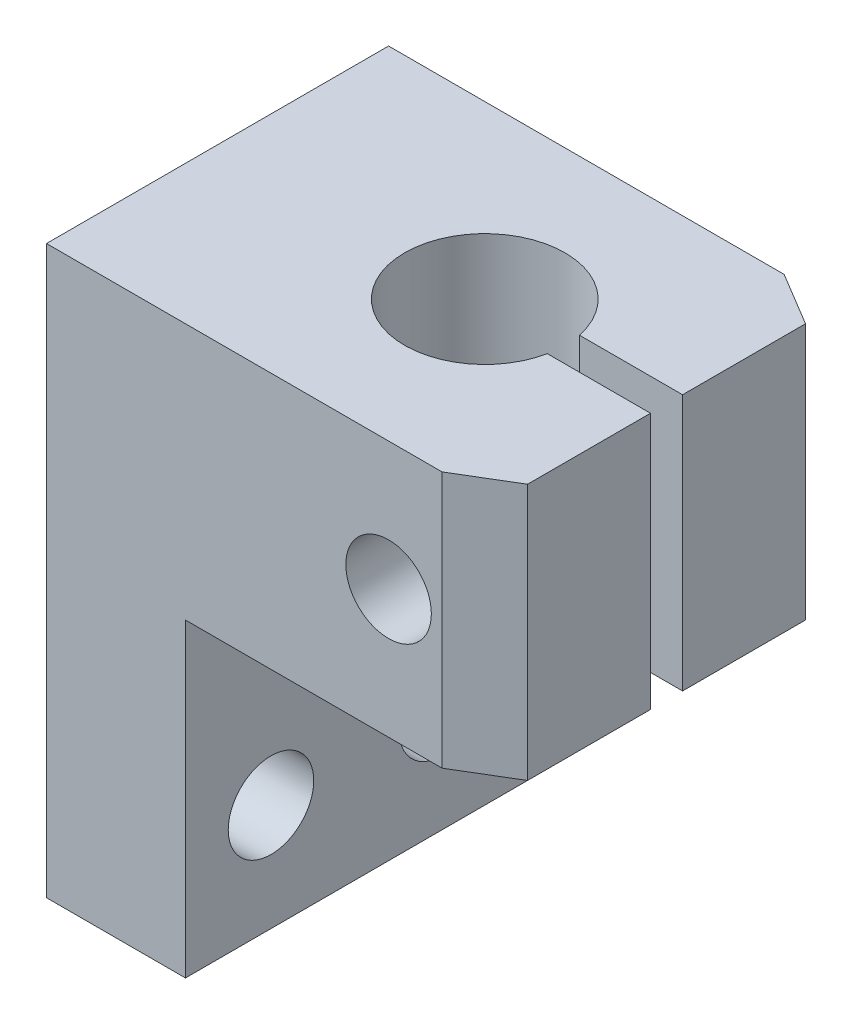
from build123d import *

# Parameters (mm, degrees)
SKETCH1_R           = 4
BOSS_EXTRUDE1_DEPTH = 32
SKETCH2_R           = 4
CUT_EXTRUDE1_DEPTH  = 75.813100457
CUT_EXTRUDE2_DEPTH  = 61.241181927
CHAMFER1_SIZE       = 5
CHAMFER1_SIZE2      = 3
CHAMFER2_SIZE       = 3
CHAMFER2_SIZE2      = 5


with BuildPart() as part:
    # Sketch1 → Boss-Extrude1 (new body)
    with BuildSketch(Plane.XY):
        Polygon((42, 0), (42, -24), (13, -24), (13, -53), (0, -53), (0, 0), align=None)
        with Locations((32, -12)):
            Circle(SKETCH1_R, mode=Mode.SUBTRACT)
    extrude(amount=BOSS_EXTRUDE1_DEPTH)

    # Sketch2 → Cut-Extrude1 (cut, through all)
    with BuildSketch(Plane.ZY):
        with Locations((8, -43)):
            Circle(SKETCH2_R)
        with Locations((24, -43)):
            Circle(SKETCH2_R)
    extrude(amount=-CUT_EXTRUDE1_DEPTH, mode=Mode.SUBTRACT)

    # Sketch3 → Cut-Extrude2 (cut, through all)
    with BuildSketch(Plane.XZ.offset(24)):
        with BuildLine():
            Line((32.348469228, 17.5), (42, 17.5))
            Line((42, 17.5), (42, 14.5))
            Line((42, 14.5), (32.348469228, 14.5))
            ThreePointArc((32.348469228, 14.5), (17.5, 16), (32.348469228, 17.5))
        make_face()
    extrude(amount=-CUT_EXTRUDE2_DEPTH, mode=Mode.SUBTRACT)

    # Chamfer1
    chamfer1_edges = [part.edges().sort_by_distance(p)[0] for p in [
        (42, -12, 32),
    ]]
    chamfer1_side = [part.faces().sort_by_distance(p)[0] for p in [
        (16.490174092, -19.485009093, 32),
    ]]
    chamfer(chamfer1_edges, length=CHAMFER1_SIZE, length2=CHAMFER1_SIZE2, reference=chamfer1_side[0])

    # Chamfer2
    chamfer2_edges = [part.edges().sort_by_distance(p)[0] for p in [
        (42, -12, 0),
    ]]
    chamfer2_side = [part.faces().sort_by_distance(p)[0] for p in [
        (42, -12, 7.25),
    ]]
    chamfer(chamfer2_edges, length=CHAMFER2_SIZE, length2=CHAMFER2_SIZE2, reference=chamfer2_side[0])


solid = part.part
